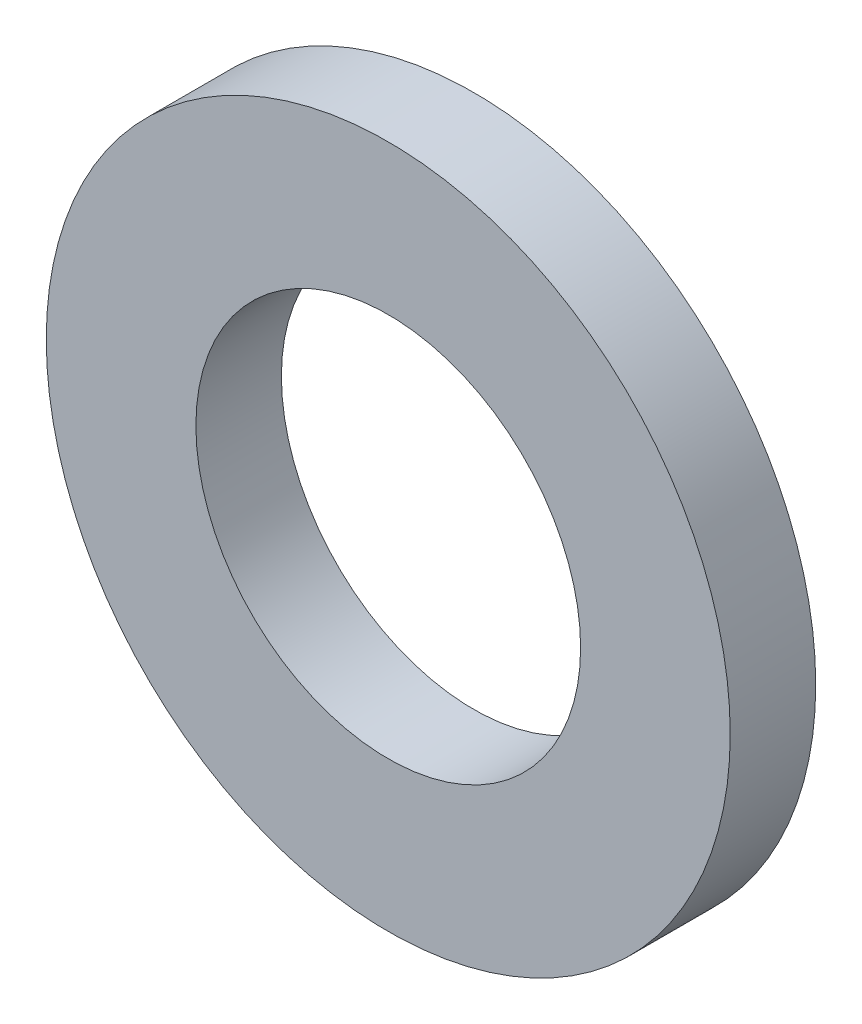
from build123d import *

# Parameters (mm, degrees)
SKETCH1_R           = 8
SKETCH1_R_2         = 4.5
BOSS_EXTRUDE1_DEPTH = 2


with BuildPart() as part:
    # Sketch1 → Boss-Extrude1 (new body)
    with BuildSketch(Plane.XY):
        Circle(SKETCH1_R)
        Circle(SKETCH1_R_2, mode=Mode.SUBTRACT)
    extrude(amount=BOSS_EXTRUDE1_DEPTH)


solid = part.part
